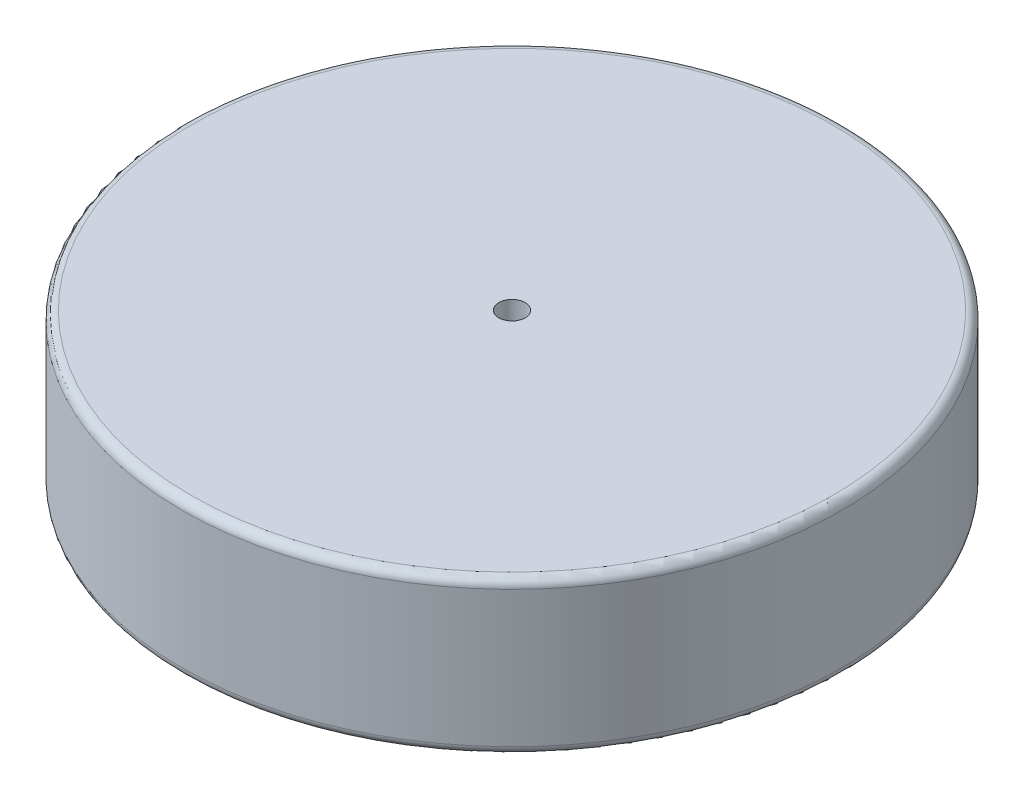
from build123d import *

# Parameters (mm, degrees)
SKETCH1_R           = 75
SKETCH1_R_2         = 3
BOSS_EXTRUDE1_DEPTH = 35
FILLET1_R           = 2


with BuildPart() as part:
    # Sketch1 → Boss-Extrude1 (new body)
    with BuildSketch(Plane(origin=(0, 0, 0), x_dir=(1, 0, 0), z_dir=(0, 1, 0))):
        with Locations(Location((0, 0, 0), (0, 0, 270))):
            Circle(SKETCH1_R)
        with Locations(Location((0, 0, 0), (0, 0, 270))):
            Circle(SKETCH1_R_2, mode=Mode.SUBTRACT)
    extrude(amount=BOSS_EXTRUDE1_DEPTH)

    # Fillet1
    fillet1_edges = [part.edges().sort_by_distance(p)[0] for p in [
        (0, 0, -75),
        (0, 35, -75),
    ]]
    fillet(fillet1_edges, radius=FILLET1_R)


solid = part.part
